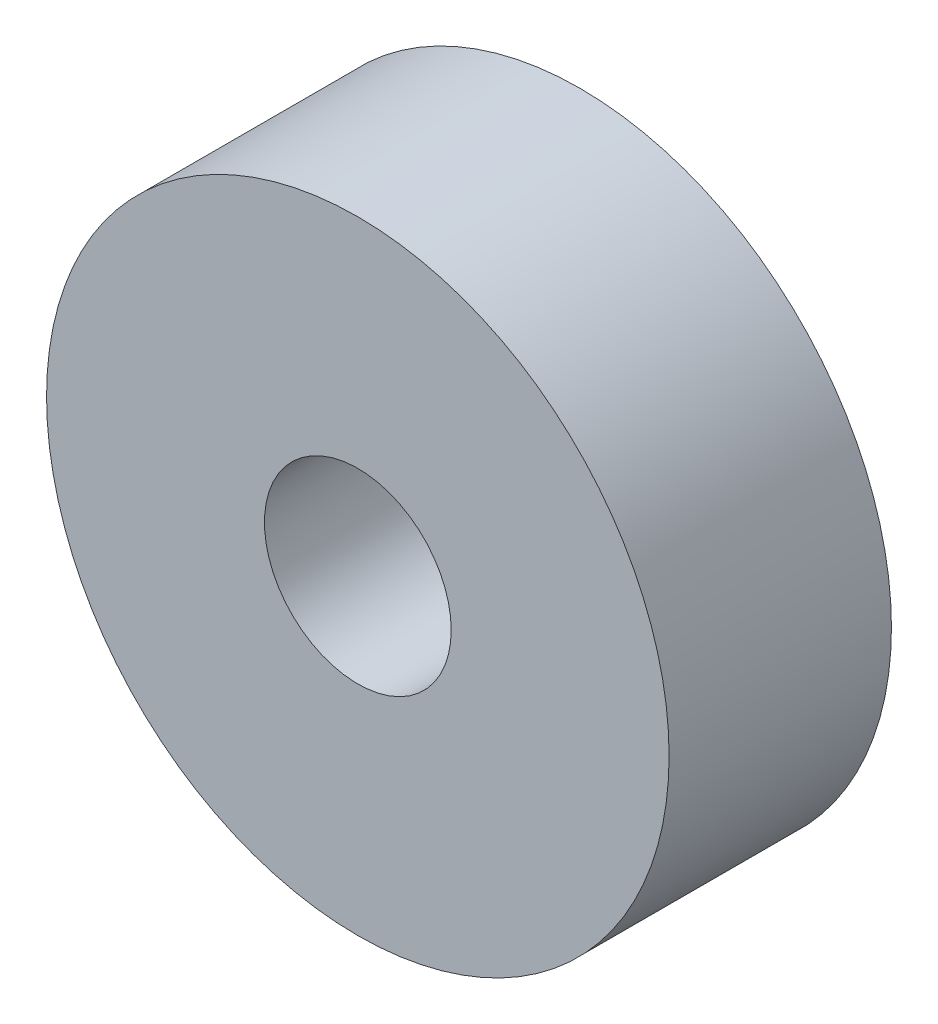
from build123d import *

# Parameters (mm, degrees)
SKETCH1_R           = 7
SKETCH1_R_2         = 2.1
BOSS_EXTRUDE1_DEPTH = 5


with BuildPart() as part:
    # Sketch1 → Boss-Extrude1 (new body)
    with BuildSketch(Plane.XY):
        Circle(SKETCH1_R)
        Circle(SKETCH1_R_2, mode=Mode.SUBTRACT)
    extrude(amount=BOSS_EXTRUDE1_DEPTH)


solid = part.part
